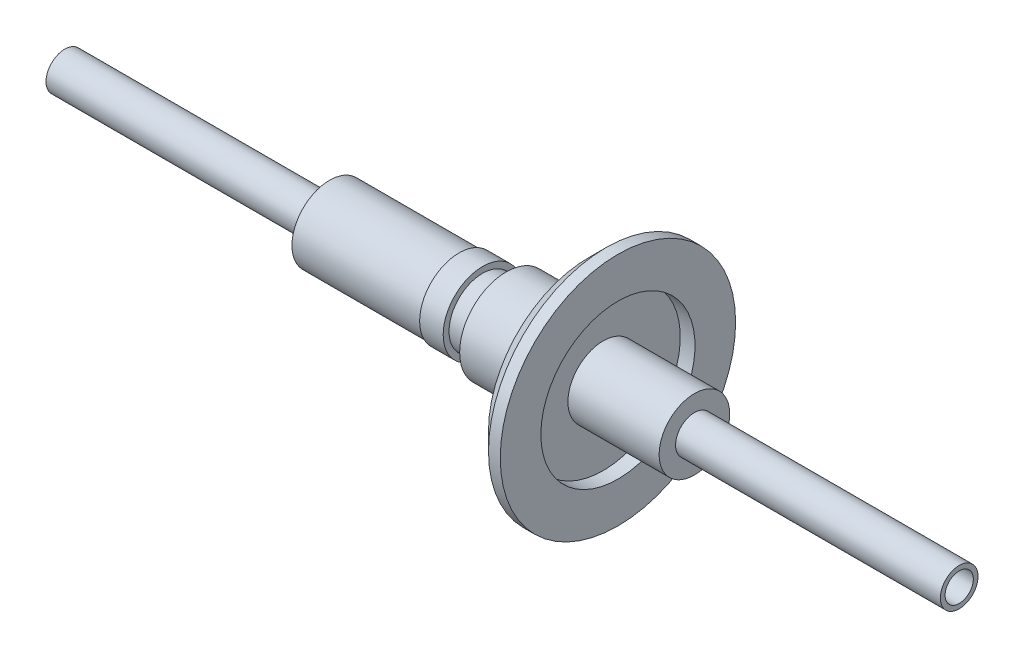
from build123d import *


with BuildPart() as part:
    # Axial profile (mm) → Full revolution (revolve)
    with BuildSketch(Plane.XY, mode=Mode.PRIVATE) as full_revolution_sk:
        Polygon((-94, 2.4), (58, 2.4), (58, 3.2), (13, 3.2), (13, 6), (-2.5, 6), (-2.5, 13.1), (0, 13.1), (0, 20), (-2, 20), (-5, 17), (-5, 7.9), (-19, 7.9), (-19, 5.7), (-23, 5.7), (-23, 6.7), (-27, 6.7), (-27, 6.4), (-49, 6.4), (-49, 3.2), (-94, 3.2), align=None)
    revolve(full_revolution_sk.sketch.rotate(Axis((-110, 0, 0), (1, 0, 0)), 90), axis=Axis((-110, 0, 0), (1, 0, 0)))


solid = part.part
